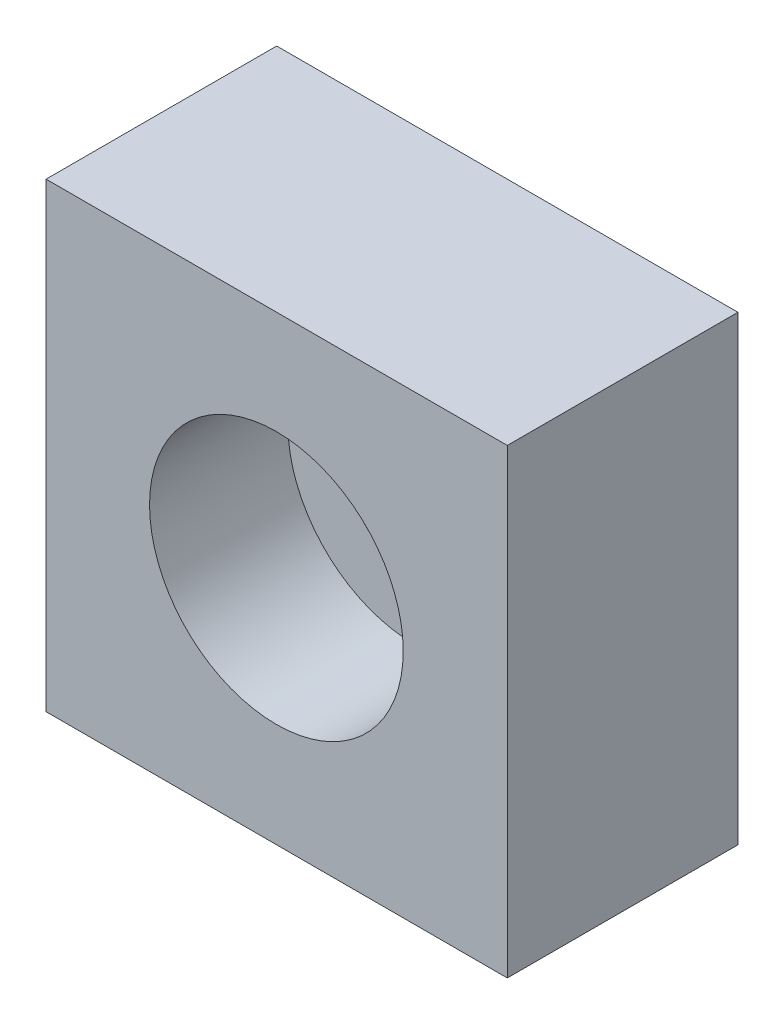
from build123d import *

# Parameters (mm, degrees)
SKETCH_1_W                              = 20
SKETCH_1_H                              = 20
BASEBOX_DEPTH                           = 10
HOLE_BLINDCBORE_THRU_DEPTH8_D           = 6
HOLE_BLINDCBORE_THRU_DEPTH8_DEPTH       = 8
HOLE_BLINDCBORE_THRU_DEPTH8_CBORE_D     = 11
HOLE_BLINDCBORE_THRU_DEPTH8_CBORE_DEPTH = 6


with BuildPart() as part:
    # 草图1 → BaseBox (new body)
    with BuildSketch(Plane.XY):
        with Locations((10, 10)):
            Rectangle(SKETCH_1_W, SKETCH_1_H)
    extrude(amount=BASEBOX_DEPTH)

    # Hole_BlindCbore_thru_depth8
    with Locations(Plane.XY.offset(10)):
        with Locations((9.986487375, 10.014305599)):
            CounterBoreHole(HOLE_BLINDCBORE_THRU_DEPTH8_D / 2, HOLE_BLINDCBORE_THRU_DEPTH8_CBORE_D / 2, HOLE_BLINDCBORE_THRU_DEPTH8_CBORE_DEPTH, depth=HOLE_BLINDCBORE_THRU_DEPTH8_DEPTH)


solid = part.part
